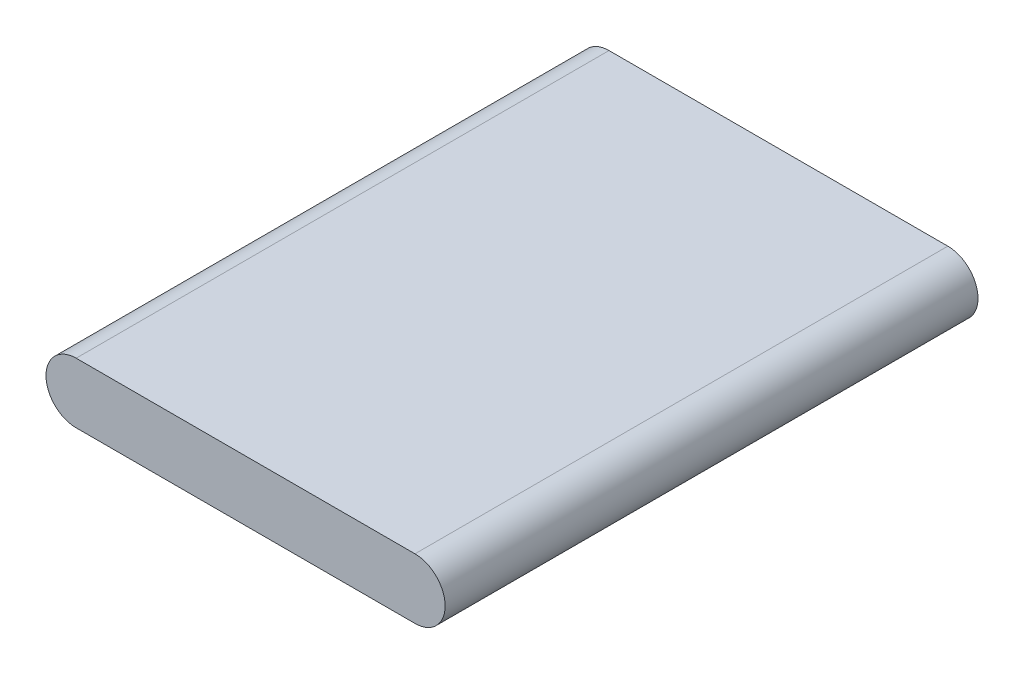
from build123d import *

# Parameters (mm, degrees)
EXTRUDE_1_DEPTH = 53


with BuildPart() as part:
    # 草图1 → 凸台-拉伸1 (new body)
    with BuildSketch(Plane.XY):
        with BuildLine():
            Line((-16.85, 3), (16.85, 3))
            ThreePointArc((16.85, 3), (19.85, 0), (16.85, -3))
            Line((16.85, -3), (-16.85, -3))
            ThreePointArc((-16.85, -3), (-19.85, 0), (-16.85, 3))
        make_face()
    extrude(amount=EXTRUDE_1_DEPTH)


solid = part.part
